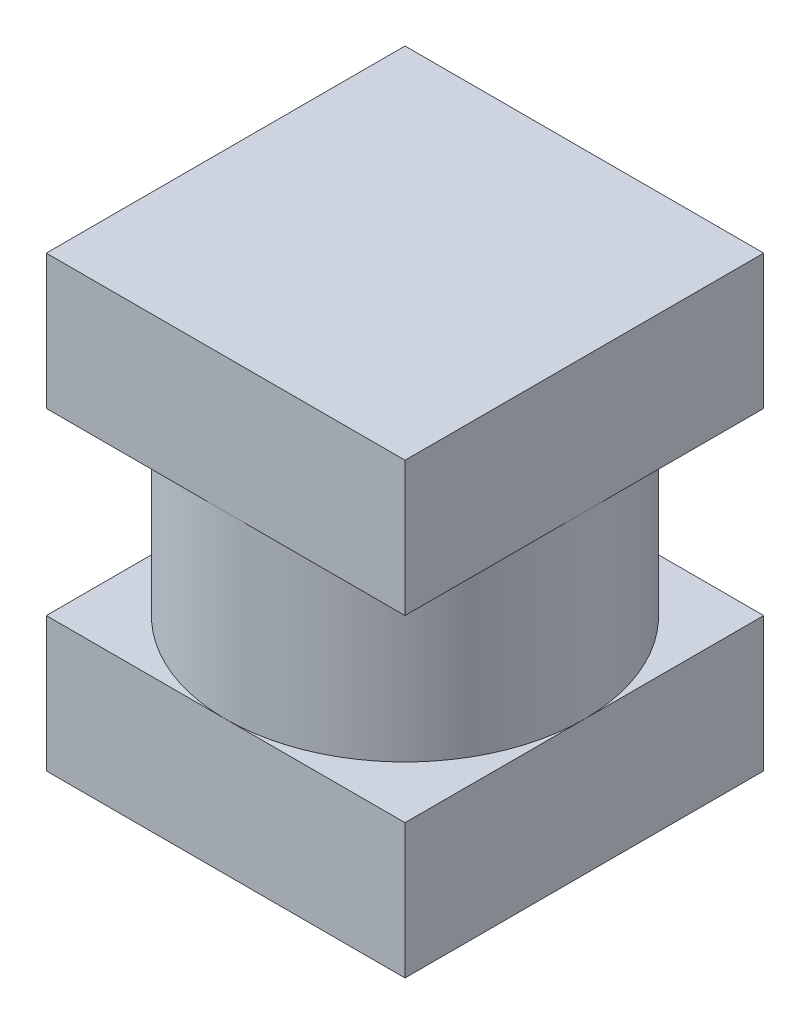
from build123d import *

# Parameters (mm, degrees)
SKETCH1_W           = 40
SKETCH1_H           = 40
BOSS_EXTRUDE1_DEPTH = 15
SKETCH2_R           = 20
BOSS_EXTRUDE2_DEPTH = 20
SKETCH3_W           = 40
SKETCH3_H           = 40
BOSS_EXTRUDE3_DEPTH = 15


with BuildPart() as part:
    # Sketch1 → Boss-Extrude1 (new body)
    with BuildSketch(Plane(origin=(0, 0, 0), x_dir=(1, 0, 0), z_dir=(0, 1, 0))):
        Rectangle(SKETCH1_W, SKETCH1_H)
    extrude(amount=BOSS_EXTRUDE1_DEPTH)

    # Sketch2 → Boss-Extrude2 (add)
    with BuildSketch(Plane(origin=(0, 15, 0), x_dir=(1, 0, 0), z_dir=(0, 1, 0))):
        with Locations(Location((0, 0, 0), (0, 0, 270))):
            Circle(SKETCH2_R)
    extrude(amount=BOSS_EXTRUDE2_DEPTH)

    # Sketch3 → Boss-Extrude3 (add)
    with BuildSketch(Plane(origin=(0, 35, 0), x_dir=(1, 0, 0), z_dir=(0, 1, 0))):
        Rectangle(SKETCH3_W, SKETCH3_H)
    extrude(amount=BOSS_EXTRUDE3_DEPTH)


solid = part.part
